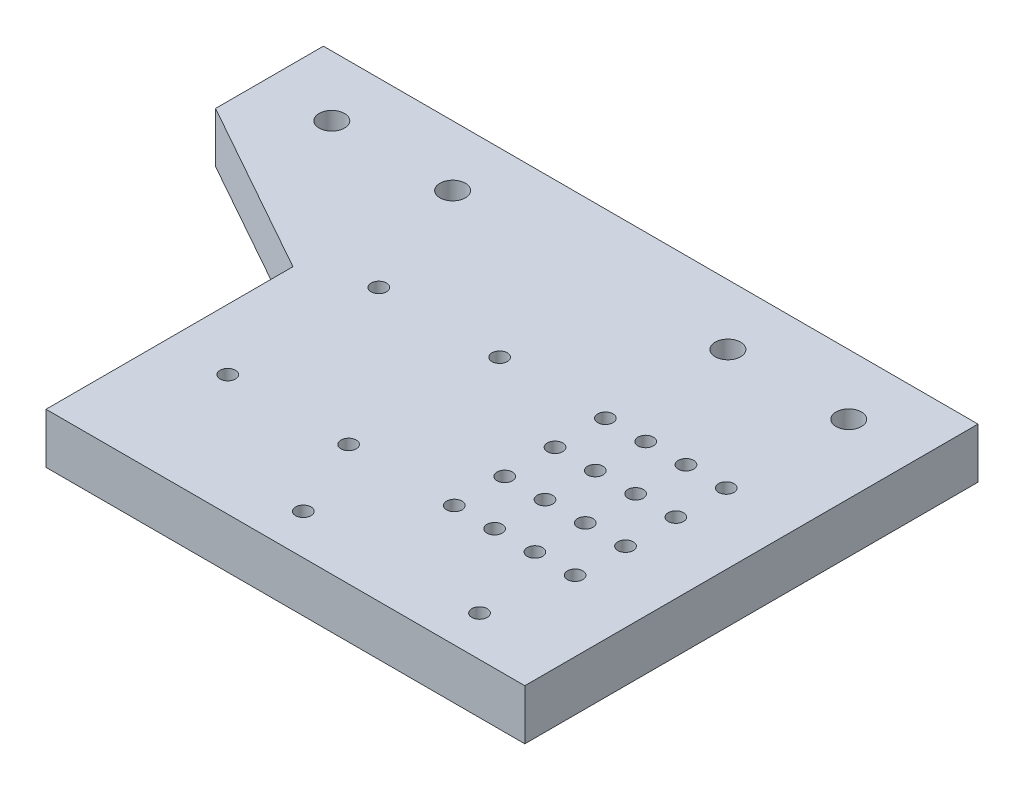
from build123d import *

# Parameters (mm, degrees)
SKETCH_1_R      = 1.525
SKETCH_1_R_2    = 2.525
EXTRUDE_1_DEPTH = 10


with BuildPart() as part:
    # 草图1 → 凸台-拉伸1 (new body)
    with BuildSketch(Plane(origin=(0, 0, 0), x_dir=(1, 0, 0), z_dir=(0, 1, 0))):
        Polygon((-63.358095006, 31.840104985), (-63.358095006, -17.203623146), (31.738923617, -17.203623146), (31.738923617, 72.796376854), (-33.261076383, 72.796376854), (-98.261076383, 72.796376854), (-98.261076383, 51.371029704), align=None)
        with Locations(Location((-27.261076383, 36.796376854, 0), (0, 0, 270))):
            Circle(SKETCH_1_R, mode=Mode.SUBTRACT)
        with Locations(Location((-51.261076383, 36.796376854, 0), (0, 0, 270))):
            Circle(SKETCH_1_R, mode=Mode.SUBTRACT)
        with Locations(Location((-51.261076383, 6.796376854, 0), (0, 0, 270))):
            Circle(SKETCH_1_R, mode=Mode.SUBTRACT)
        with Locations(Location((-27.261076383, 6.796376854, 0), (0, 0, 270))):
            Circle(SKETCH_1_R, mode=Mode.SUBTRACT)
        with Locations(Location((-20.261076383, -9.203623146, 0), (0, 0, 270))):
            Circle(SKETCH_1_R, mode=Mode.SUBTRACT)
        with Locations(Location((14.738923617, -9.203623146, 0), (0, 0, 270))):
            Circle(SKETCH_1_R, mode=Mode.SUBTRACT)
        with Locations(Location((-6.261076383, 6.796376854, 0), (0, 0, 270))):
            Circle(SKETCH_1_R, mode=Mode.SUBTRACT)
        with Locations(Location((1.73657712, 6.796376854, 0), (0, 0, 270))):
            Circle(SKETCH_1_R, mode=Mode.SUBTRACT)
        with Locations(Location((9.73657712, 6.796376854, 0), (0, 0, 270))):
            Circle(SKETCH_1_R, mode=Mode.SUBTRACT)
        with Locations(Location((17.738923617, 6.796376854, 0), (0, 0, 270))):
            Circle(SKETCH_1_R, mode=Mode.SUBTRACT)
        with Locations(Location((-6.261076383, 16.796376854, 0), (0, 0, 270))):
            Circle(SKETCH_1_R, mode=Mode.SUBTRACT)
        with Locations(Location((1.73657712, 16.796376854, 0), (0, 0, 270))):
            Circle(SKETCH_1_R, mode=Mode.SUBTRACT)
        with Locations(Location((9.73657712, 16.796376854, 0), (0, 0, 270))):
            Circle(SKETCH_1_R, mode=Mode.SUBTRACT)
        with Locations(Location((17.738923617, 16.796376854, 0), (0, 0, 270))):
            Circle(SKETCH_1_R, mode=Mode.SUBTRACT)
        with Locations(Location((-84.594304082, 60.796376854, 0), (0, 0, 270))):
            Circle(SKETCH_1_R_2, mode=Mode.SUBTRACT)
        with Locations(Location((-60.594304082, 60.796376854, 0), (0, 0, 270))):
            Circle(SKETCH_1_R_2, mode=Mode.SUBTRACT)
        with Locations(Location((-6.261076383, 26.796376854, 0), (0, 0, 270))):
            Circle(SKETCH_1_R, mode=Mode.SUBTRACT)
        with Locations(Location((1.73657712, 26.796376854, 0), (0, 0, 270))):
            Circle(SKETCH_1_R, mode=Mode.SUBTRACT)
        with Locations(Location((9.73657712, 26.796376854, 0), (0, 0, 270))):
            Circle(SKETCH_1_R, mode=Mode.SUBTRACT)
        with Locations(Location((17.738923617, 26.796376854, 0), (0, 0, 270))):
            Circle(SKETCH_1_R, mode=Mode.SUBTRACT)
        with Locations(Location((-6.261076383, 36.796376854, 0), (0, 0, 270))):
            Circle(SKETCH_1_R, mode=Mode.SUBTRACT)
        with Locations(Location((1.73657712, 36.796376854, 0), (0, 0, 270))):
            Circle(SKETCH_1_R, mode=Mode.SUBTRACT)
        with Locations(Location((9.73657712, 36.796376854, 0), (0, 0, 270))):
            Circle(SKETCH_1_R, mode=Mode.SUBTRACT)
        with Locations(Location((17.738923617, 36.796376854, 0), (0, 0, 270))):
            Circle(SKETCH_1_R, mode=Mode.SUBTRACT)
        with Locations(Location((-5.927848684, 60.796376854, 0), (0, 0, 270))):
            Circle(SKETCH_1_R_2, mode=Mode.SUBTRACT)
        with Locations(Location((18.072151316, 60.796376854, 0), (0, 0, 270))):
            Circle(SKETCH_1_R_2, mode=Mode.SUBTRACT)
    extrude(amount=EXTRUDE_1_DEPTH)


solid = part.part
